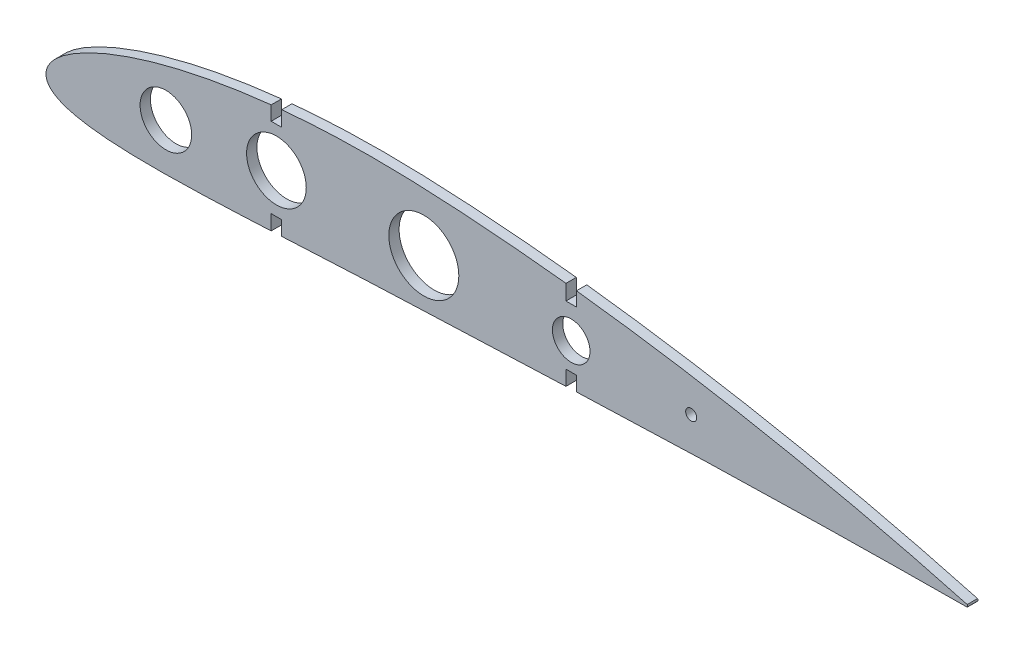
from build123d import *

# Parameters (mm, degrees)
SKETCH_1_R      = 7
SKETCH_1_R_2    = 8.1
SKETCH_1_R_3    = 9.5
SKETCH_1_R_4    = 5.1
SKETCH_1_R_5    = 1.5
EXTRUDE_1_DEPTH = 1.4


with BuildPart() as part:
    # Эскиз1 → Бобышка-Вытянуть1 (new, symmetric)
    # profile 1 of 2: a face of its own
    with BuildSketch(Plane.XY):
        with BuildLine():
            Line((63.957619318, 19.450139662), (61.107619318, 19.450139662))
            Line((61.107619318, 19.450139662), (61.107619318, 23.303137173))
            add(Edge.make_bspline(
                [(61.107619318, 23.303137173), (59.917945614, 23.176751945), (56.739740439, 22.81448979), (51.605762688, 22.119065522), (45.744400311, 21.156564432), (39.995857594, 20.03537139), (34.397919842, 18.756316235), (29.010382103, 17.327615608), (23.925798408, 15.771864922), (19.27067884, 14.134269435), (15.179098391, 12.483335438), (11.74047579, 10.895610996), (8.959371869, 9.429577366), (6.76089118, 8.1086032), (5.033709748, 6.924638056), (3.671694933, 5.854229665), (2.592101123, 4.871305369), (1.738175668, 3.952595744), (1.06987083, 3.080946374), (0.57164541, 2.241622103), (0.215773899, 1.430785398), (0.102255581, 0.883241695), (0.047975, 0.621425001)],
                knots=[0.740090669, 0.740090669, 0.740090669, 0.740090669, 0.7539832, 0.77723469, 0.800246382, 0.822950709, 0.845237155, 0.866915896, 0.887662335, 0.906968281, 0.924203157, 0.938878975, 0.950931611, 0.960693484, 0.968646729, 0.975232933, 0.980794744, 0.985583761, 0.989781539, 0.993521313, 0.996902113, 1, 1, 1, 1], degree=3))
            add(Edge.make_bspline(
                [(0.047975, 0.621425001), (0.02271382, 0.373490086), (-0.027820789, -0.122499974), (0.077991212, -0.884434589), (0.34969565, -1.63883807), (0.814331135, -2.365068923), (1.46348078, -3.039275244), (2.290973016, -3.660999469), (3.30592875, -4.23577962), (4.535255619, -4.773674143), (6.029745688, -5.282192164), (7.868981215, -5.765316676), (10.168831391, -6.221716592), (13.075438188, -6.63961873), (16.728115362, -6.992956737), (21.189952096, -7.247345144), (26.399984415, -7.376638848), (32.197398564, -7.376256913), (38.397806759, -7.261436579), (44.857621768, -7.056641358), (51.486543096, -6.786453532), (56.920566709, -6.533358441), (60.139839208, -6.376114839), (61.107619318, -6.32836923)],
                knots=[0, 0, 0, 0, 0.002941446, 0.005884319, 0.00901613, 0.012364547, 0.016007934, 0.020036845, 0.024573728, 0.029783835, 0.03589701, 0.04324044, 0.052275965, 0.063634589, 0.077983176, 0.095698161, 0.116520086, 0.13966073, 0.16431217, 0.18991889, 0.216157201, 0.242837762, 0.254306514, 0.254306514, 0.254306514, 0.254306514], degree=3))
            Line((61.107619318, -6.32836923), (61.107619318, -2.257745247))
            Line((61.107619318, -2.257745247), (63.957619318, -2.257745247))
            Line((63.957619318, -2.257745247), (63.957619318, -6.186566126))
            add(Edge.make_bspline(
                [(63.957619318, -6.186566126), (64.317823095, -6.168514758), (66.969747676, -6.035316313), (71.910772709, -5.784005174), (78.771375576, -5.439680449), (85.610498609, -5.110951246), (92.432107589, -4.804953317), (99.25503119, -4.531981644), (106.097378404, -4.278274658), (112.96921168, -4.00308991), (119.864404254, -3.723176166), (126.773860473, -3.440067276), (133.855552455, -3.151608468), (138.633361552, -2.960411351), (141.107619318, -2.86287629)],
                knots=[0.265564796, 0.265564796, 0.265564796, 0.265564796, 0.269833583, 0.296993022, 0.324123272, 0.351139107, 0.378035509, 0.404946016, 0.431960837, 0.459078395, 0.4863474, 0.51364083, 0.540928595, 0.570237104, 0.570237104, 0.570237104, 0.570237104], degree=3))
            Line((141.107619318, -2.86287629), (141.107619318, 1.193130543))
            Line((141.107619318, 1.193130543), (143.957619318, 1.193130543))
            Line((143.957619318, 1.193130543), (143.957619318, -2.751209627))
            add(Edge.make_bspline(
                [(143.957619318, -2.751209627), (145.13020609, -2.705557458), (148.596084852, -2.571725453), (154.352602411, -2.355626415), (161.225044134, -2.109369921), (168.090869746, -1.876634074), (172.712313278, -1.729793129), (175.045239361, -1.65837681), (175.091334091, -1.656966802)],
                knots=[0.581490104, 0.581490104, 0.581490104, 0.581490104, 0.595379569, 0.622543445, 0.64967326, 0.676775201, 0.703855228, 0.704401069, 0.704401069, 0.704401069, 0.704401069], degree=3))
            ThreePointArc((175.091334091, -1.656966802), (165.940456932, 7.493910357), (175.091334091, 16.644787515))
            add(Edge.make_bspline(
                [(175.091334091, 16.644787515), (174.212389388, 16.789012775), (171.154404183, 17.284960287), (165.914317095, 18.099827841), (159.368680729, 19.054501815), (152.821805128, 19.944885603), (147.683892721, 20.591912914), (144.728786809, 20.943344409), (143.957619318, 21.033629847)],
                knots=[0.296903142, 0.296903142, 0.296903142, 0.296903142, 0.30724642, 0.332878042, 0.358484538, 0.384061186, 0.409602822, 0.418619192, 0.418619192, 0.418619192, 0.418619192], degree=3))
            Line((143.957619318, 21.033629847), (143.957619318, 17.19883932))
            Line((143.957619318, 17.19883932), (141.107619318, 17.19883932))
            Line((141.107619318, 17.19883932), (141.107619318, 21.360787161))
            add(Edge.make_bspline(
                [(141.107619318, 21.360787161), (140.647203073, 21.412583326), (138.008124909, 21.706530989), (133.19183673, 22.212004255), (126.658683026, 22.825721434), (120.136770918, 23.363973271), (113.62856714, 23.824677329), (107.152732037, 24.200242598), (100.741095693, 24.498399513), (94.411752715, 24.686649771), (88.155917993, 24.740095652), (81.949043055, 24.658849145), (75.780520591, 24.441013809), (69.785413798, 24.089605746), (65.850842722, 23.766532071), (63.957619318, 23.588464287)],
                knots=[0.429723551, 0.429723551, 0.429723551, 0.429723551, 0.435103874, 0.460559416, 0.485959195, 0.51130307, 0.536551515, 0.561723366, 0.586628867, 0.611085431, 0.6352512, 0.659272176, 0.683163753, 0.706922144, 0.729003809, 0.729003809, 0.729003809, 0.729003809], degree=3))
            Line((63.957619318, 23.588464287), (63.957619318, 19.450139662))
        make_face()
        with Locations((32.532619318, 5.448144701)):
            Circle(SKETCH_1_R, mode=Mode.SUBTRACT)
        with Locations((62.532619318, 8.596197208)):
            Circle(SKETCH_1_R_2, mode=Mode.SUBTRACT)
        with Locations((102.532619318, 8.596197208)):
            Circle(SKETCH_1_R_3, mode=Mode.SUBTRACT)
        with Locations((142.532619318, 8.596197208)):
            Circle(SKETCH_1_R_4, mode=Mode.SUBTRACT)
    # profile 2 of 2: a face of its own
    with BuildSketch(Plane.XY):
        with BuildLine():
            add(Edge.make_bspline(
                [(250, 0.315), (249.15566774, 0.545019818), (246.720175698, 1.208516243), (242.391332083, 2.358339053), (236.849761204, 3.787625364), (230.779918279, 5.298008837), (224.455917947, 6.812866028), (218.030543496, 8.291610632), (211.562405045, 9.719735057), (205.072411509, 11.092374932), (198.567970913, 12.407850726), (192.052369914, 13.665297924), (185.527619973, 14.864093303), (179.872800983, 15.850364437), (176.392239334, 16.431323122), (175.091334091, 16.644787515)],
                knots=[0, 0, 0, 0, 0.0101622, 0.029313053, 0.052011605, 0.076619468, 0.101948061, 0.127526132, 0.153184131, 0.178867888, 0.204557903, 0.230245712, 0.255925967, 0.281594302, 0.296903142, 0.296903142, 0.296903142, 0.296903142], degree=3))
            ThreePointArc((175.091334091, 16.644787515), (165.940456932, 7.493910357), (175.091334091, -1.656966802))
            add(Edge.make_bspline(
                [(175.091334091, -1.656966802), (177.330680613, -1.588466601), (181.854695323, -1.455127256), (188.663234462, -1.270383377), (195.516645168, -1.101112884), (202.369532894, -0.948617189), (211.49919029, -0.767742353), (220.603098666, -0.619939742), (229.617630172, -0.50292618), (236.087353854, -0.431514192), (241.980776913, -0.376520461), (246.558970011, -0.339535886), (249.120490965, -0.321271242), (250, -0.315)],
                knots=[0.704401069, 0.704401069, 0.704401069, 0.704401069, 0.730918775, 0.757971338, 0.785017763, 0.812061651, 0.839103366, 0.893099152, 0.919831065, 0.945809917, 0.969680601, 0.989589706, 1, 1, 1, 1], degree=3))
            ThreePointArc((250, -0.315), (250.130477272, 0), (250, 0.315))
        make_face()
        with Locations((175.091334091, 7.493910357)):
            Circle(SKETCH_1_R_5, mode=Mode.SUBTRACT)
    extrude(amount=EXTRUDE_1_DEPTH, both=True)


solid = part.part
